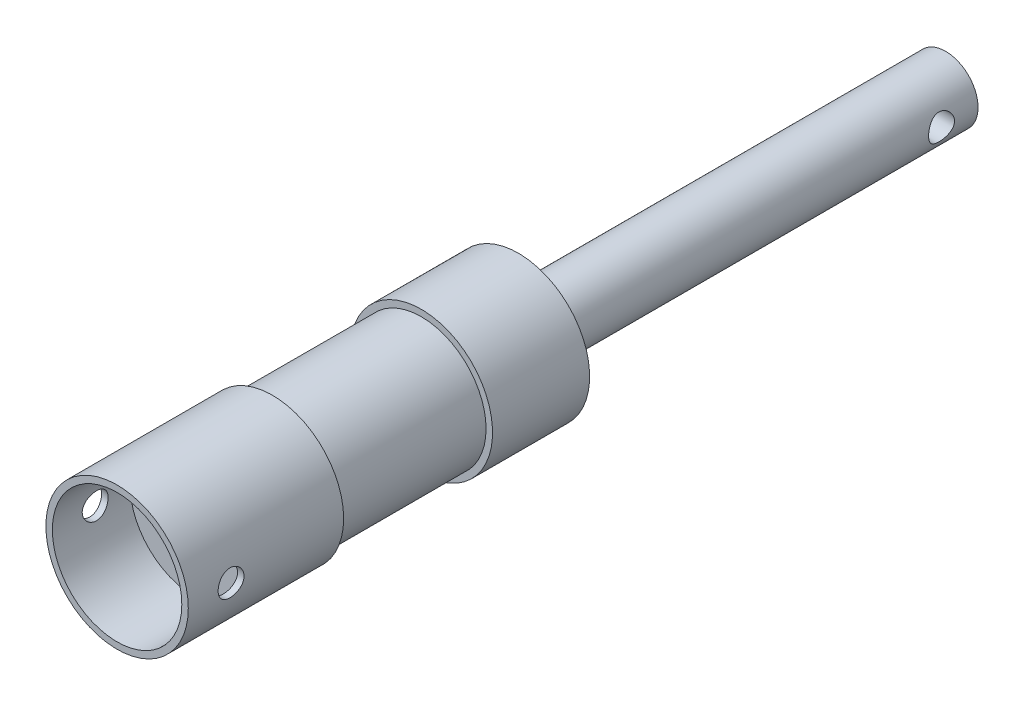
from build123d import *

# Parameters (mm, degrees)
SKETCH1_R                = 10
BOSS_EXTRUDE1_DEPTH      = 50
EXTRUDE_THIN1_START      = -15
SKETCH2_R                = 11
SKETCH2_R_2              = 10
EXTRUDE_THIN1_DEPTH      = 15
SKETCH3_R                = 5
BOSS_EXTRUDE2_DEPTH      = 66
CUT_EXTRUDE3_DEPTH       = 118.038455219
CUT_EXTRUDE3_DEPTH_BACK  = 118.038455219
SKETCH4_R                = 2
EXTRUDE_THIN2_DEPTH      = 12
EXTRUDE_THIN2_DEPTH_BACK = 12
SKETCH5_R                = 11
SKETCH5_R_2              = 10
CUT_EXTRUDE4_DEPTH       = 118.038455318
CUT_EXTRUDE4_DEPTH_BACK  = 118.038455318
SKETCH7_R                = 2


with BuildPart() as part:
    # Sketch1 → Boss-Extrude1 (new body)
    with BuildSketch(Plane.XY):
        Circle(SKETCH1_R)
    extrude(amount=-BOSS_EXTRUDE1_DEPTH)

    # Sketch2 → Extrude-Thin1 (add)
    with BuildSketch(Plane(origin=(0, 0, -50), x_dir=(-1, 0, 0), z_dir=(0, 0, -1)).offset(EXTRUDE_THIN1_START)):
        Circle(SKETCH2_R)
        Circle(SKETCH2_R_2, mode=Mode.SUBTRACT)
    extrude(amount=EXTRUDE_THIN1_DEPTH)

    # Sketch3 → Boss-Extrude2 (add)
    with BuildSketch(Plane(origin=(0, 0, -50), x_dir=(-1, 0, 0), z_dir=(0, 0, -1))):
        Circle(SKETCH3_R)
    extrude(amount=BOSS_EXTRUDE2_DEPTH)

    # Sketch4 → Cut-Extrude3 (cut, two sides: drawn at the far end of the back side and taken through both)
    with BuildSketch(Plane(origin=(0, 0, 0), x_dir=(0, 0, -1), z_dir=(1, 0, 0)).offset(-CUT_EXTRUDE3_DEPTH_BACK)):
        with Locations((110.360244091, 0)):
            Circle(SKETCH4_R)
    extrude(amount=CUT_EXTRUDE3_DEPTH + CUT_EXTRUDE3_DEPTH_BACK, mode=Mode.SUBTRACT)

    # Sketch5 → Extrude-Thin2 (add, two sides: drawn at the far end of the back side and taken through both)
    with BuildSketch(Plane.XY.offset(-EXTRUDE_THIN2_DEPTH_BACK)):
        Circle(SKETCH5_R)
        Circle(SKETCH5_R_2, mode=Mode.SUBTRACT)
    extrude(amount=EXTRUDE_THIN2_DEPTH + EXTRUDE_THIN2_DEPTH_BACK)

    # Sketch7 → Cut-Extrude4 (cut, two sides: drawn at the far end of the back side and taken through both)
    with BuildSketch(Plane(origin=(0, 0, 0), x_dir=(0, 0, -1), z_dir=(1, 0, 0)).offset(-CUT_EXTRUDE4_DEPTH_BACK)):
        with Locations((-5.38623627, 0)):
            Circle(SKETCH7_R)
    extrude(amount=CUT_EXTRUDE4_DEPTH + CUT_EXTRUDE4_DEPTH_BACK, mode=Mode.SUBTRACT)


solid = part.part
